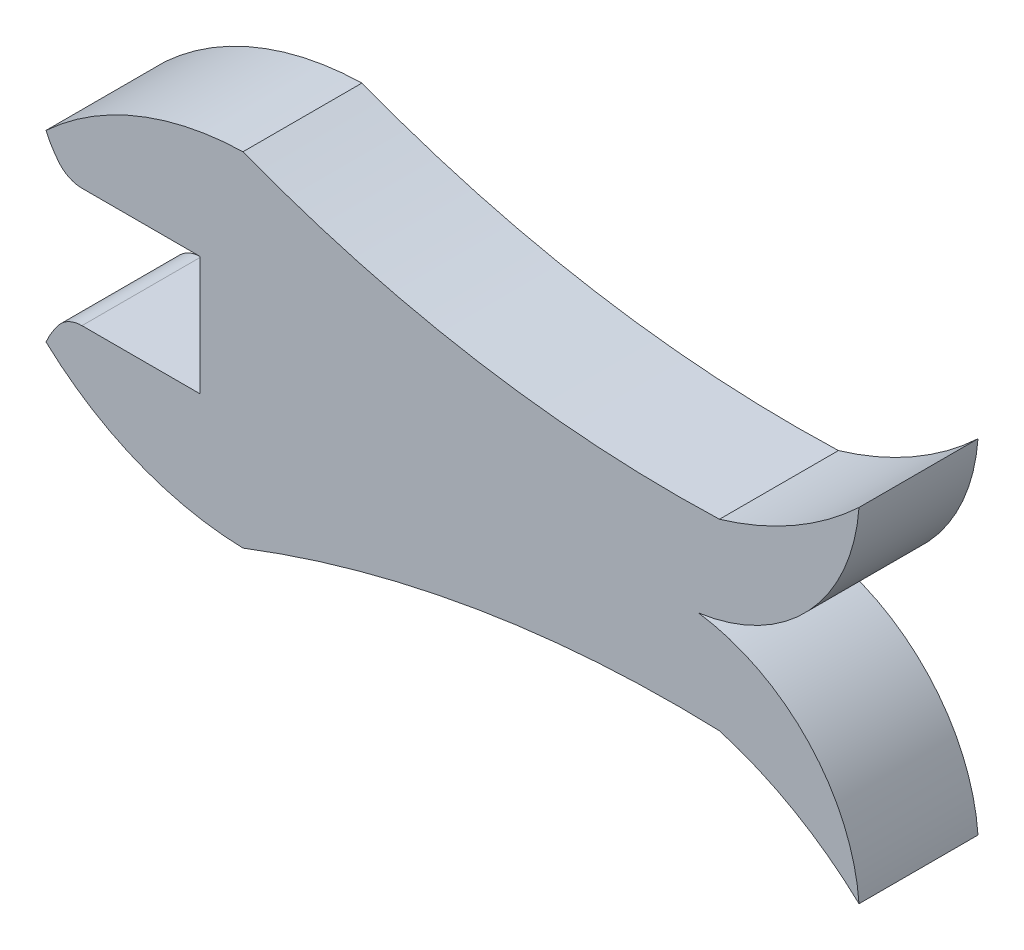
from build123d import *

# Parameters (mm, degrees)
BOSS_EXTRUDE1_DEPTH = 1.524


with BuildPart() as part:
    # Sketch1 → Boss-Extrude1 (new body)
    with BuildSketch(Plane.XY):
        with BuildLine():
            Line((121.523623664, 0), (120.01155741, 0))
            ThreePointArc((120.01155741, 0), (119.847826563, 0.036974987), (119.71587496, 0.140723308))
            ThreePointArc((119.71587496, 0.140723308), (119.624223582, 0.270551073), (119.550930958, 0.411559635))
            ThreePointArc((119.550930958, 0.411559635), (120.718745933, 1.154856432), (122.0741261, 1.436328542))
            ThreePointArc((122.0741261, 1.436328542), (125.07411423, 0.615177069), (128.177782779, 0.411559635))
            ThreePointArc((128.177782779, 0.411559635), (129.131308323, 0.819549331), (129.965124825, 1.436328542))
            ThreePointArc((129.965124825, 1.436328542), (129.325202776, -0.025891409), (127.908964253, -0.762))
            ThreePointArc((127.908964253, -0.762), (129.325202776, -1.498108591), (129.965124825, -2.960328542))
            ThreePointArc((129.965124825, -2.960328542), (129.131308323, -2.343549331), (128.177782779, -1.935559635))
            ThreePointArc((128.177782779, -1.935559635), (125.07411423, -2.139177069), (122.0741261, -2.960328542))
            ThreePointArc((122.0741261, -2.960328542), (120.718745933, -2.678856432), (119.550930958, -1.935559635))
            ThreePointArc((119.550930958, -1.935559635), (119.624223582, -1.794551073), (119.71587496, -1.664723308))
            ThreePointArc((119.71587496, -1.664723308), (119.847826563, -1.560974987), (120.01155741, -1.524))
            Line((120.01155741, -1.524), (121.523623664, -1.524))
            Line((121.523623664, -1.524), (121.523623664, 0))
        make_face()
    extrude(amount=BOSS_EXTRUDE1_DEPTH)


solid = part.part
